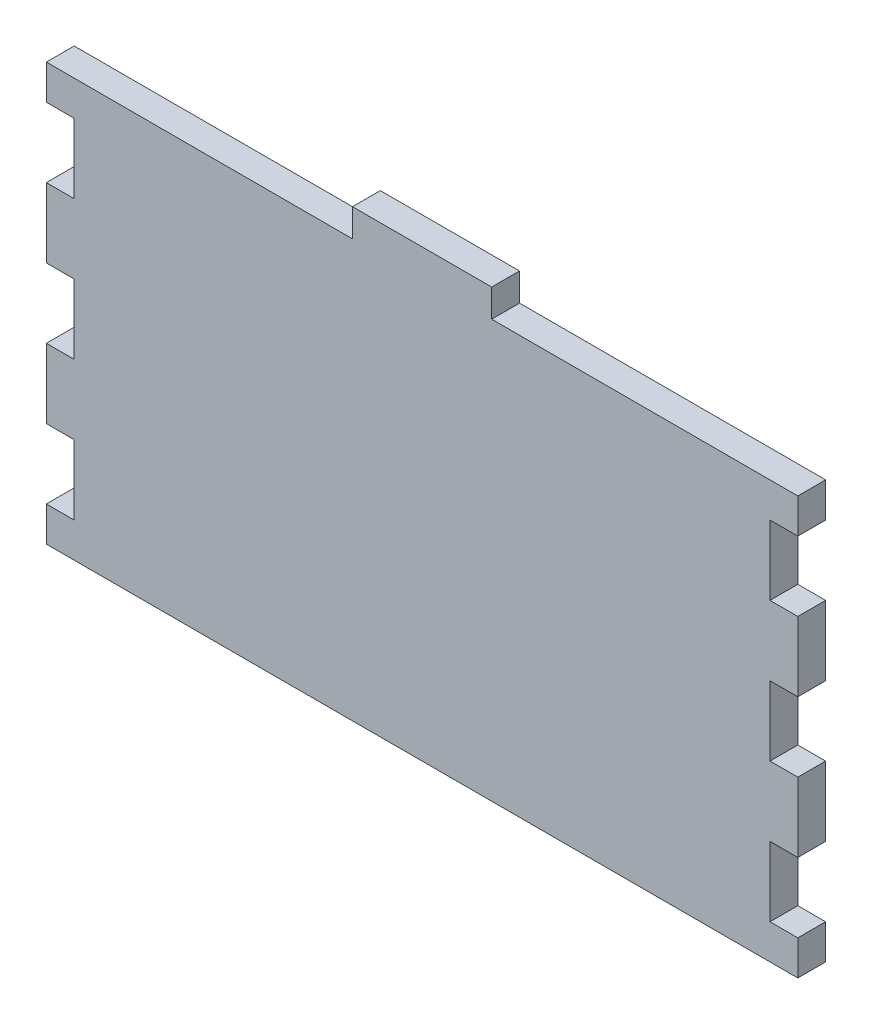
from build123d import *

# Parameters (mm, degrees)
SKETCH1_W           = 4
SKETCH1_H           = 5
BOSS_EXTRUDE1_DEPTH = 4
SKETCH2_W           = 20
SKETCH2_H           = 4
BOSS_EXTRUDE2_DEPTH = 4


with BuildPart() as part:
    # Sketch1 → Boss-Extrude1 (new body)
    with BuildSketch(Plane.XY):
        Polygon((-40, 30), (-50, 30), (-50, 25), (-50, 20), (-50, 15), (-50, 10), (-50, 5), (-50, -5), (-50, -10), (-50, -15), (-50, -20), (-50, -25), (-50, -30), (50, -30), (50, -25.221238938), (50, -25), (50, -20), (50, -15), (50, -10), (50, -5), (50, 0), (50, 5), (50, 6.10619469), (50, 10), (50, 15), (50, 20), (50, 25), (50, 30), (40, 30), (30, 30), (20, 30), (10, 30), (0, 30), (-10, 30), (-20, 30), (-30, 30), align=None)
        Polygon((-50, 10), (-50, 15), (-54, 15), (-54, 5), (-50, 5), align=None)
        with Locations((-52, 27.5)):
            Rectangle(SKETCH1_W, SKETCH1_H)
        Polygon((-50, -10), (-50, -5), (-54, -5), (-54, -15), (-50, -15), align=None)
        with Locations((-52, -27.5)):
            Rectangle(SKETCH1_W, SKETCH1_H)
        Polygon((54, 15), (50, 15), (50, 10), (50, 6.10619469), (50, 5), (54, 5), align=None)
        with Locations((52, 27.5)):
            Rectangle(SKETCH1_W, SKETCH1_H)
        Polygon((50, -10), (50, -15), (54, -15), (54, -5), (50, -5), align=None)
        Polygon((50, -25.221238938), (50, -30), (54, -30), (54, -25), (50, -25), align=None)
    extrude(amount=BOSS_EXTRUDE1_DEPTH)

    # Sketch2 → Boss-Extrude2 (add)
    with BuildSketch(Plane.XY.offset(4)):
        with Locations((0, 32)):
            Rectangle(SKETCH2_W, SKETCH2_H)
    extrude(amount=-BOSS_EXTRUDE2_DEPTH)


solid = part.part
